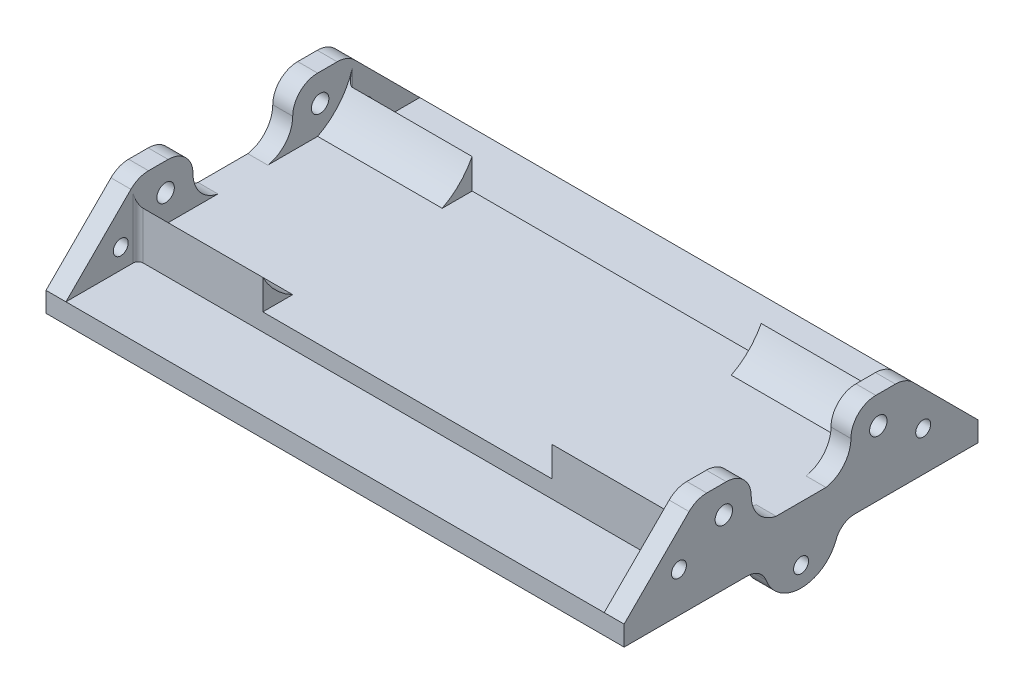
from build123d import *

# Parameters (mm, degrees)
BOSS_EXTRUDE1_START             = 3.5
SKETCH1_W                       = 116
SKETCH1_H                       = 42
BOSS_EXTRUDE1_DEPTH             = 3.5
BOSS_EXTRUDE2_REACH             = 64.081
SKETCH2_R                       = 1.75
BOSS_EXTRUDE2_DIRECTION_2_REACH = 64.081
SKETCH2_3_R                     = 1.75
CUT_EXTRUDE1_DEPTH              = 54
BOSS_EXTRUDE3_DEPTH             = 25
BOSS_EXTRUDE5_START             = -4
SKETCH4_R                       = 1.5
BOSS_EXTRUDE5_DEPTH             = 4
SKETCH5_R                       = 1.5
BOSS_EXTRUDE6_DEPTH             = 4
FILLET1_R                       = 5
FILLET2_R                       = 1
SKETCH6_W                       = 116
SKETCH6_H                       = 71
BOSS_EXTRUDE7_DEPTH             = 4
SKETCH7_R                       = 1.5
BOSS_EXTRUDE8_DEPTH             = 4
LPATTERN1_COUNT                 = 2
LPATTERN1_PITCH                 = 112
FILLET3_R                       = 4


with BuildPart() as part:
    # Sketch1 → Boss-Extrude1 (new body)
    with BuildSketch(Plane(origin=(0, 0, 0), x_dir=(1, 0, 0), z_dir=(0, 1, 0)).offset(BOSS_EXTRUDE1_START)):
        Rectangle(SKETCH1_W, SKETCH1_H)
    extrude(amount=BOSS_EXTRUDE1_DEPTH)

    # Boss-Extrude2: up to this face of the body (flat: up to its plane)
    boss_extrude2_end = Plane(part.part.faces().sort_by_distance((58, 5.25, 0))[0])
    # Sketch2 → Boss-Extrude2 (add, up to the picked face)
    with BuildSketch(Plane(origin=(0, 0, 0), x_dir=(0, 0, -1), z_dir=(1, 0, 0)), mode=Mode.PRIVATE) as boss_extrude2_sk1:
        with BuildLine():
            ThreePointArc((10, 13), (8.586149806, 9.094875162), (5, 7))
            Line((5, 7), (10, 7))
            Line((10, 7), (21, 7))
            Line((21, 7), (21, 18))
            Line((21, 18), (15, 18))
            ThreePointArc((15, 18), (11.464466094, 16.535533906), (10, 13))
        make_face()
        with Locations(Location((15.5, 12.475, 0), (0, 0, 180))):
            Circle(SKETCH2_R, mode=Mode.SUBTRACT)
    boss_extrude2_tool1 = split(extrude(boss_extrude2_sk1.sketch, amount=BOSS_EXTRUDE2_REACH, mode=Mode.PRIVATE), bisect_by=boss_extrude2_end, keep=Keep.BOTH, mode=Mode.PRIVATE)
    # Sketch2 → Boss-Extrude2 (add, up to the picked face)
    with BuildSketch(Plane(origin=(0, 0, 0), x_dir=(0, 0, -1), z_dir=(1, 0, 0)), mode=Mode.PRIVATE) as boss_extrude2_sk2:
        with BuildLine():
            Line((-21, 18), (-21, 7))
            Line((-21, 7), (-5, 7))
            ThreePointArc((-5, 7), (-8.586149806, 9.094875162), (-10, 13))
            ThreePointArc((-10, 13), (-11.464466094, 16.535533906), (-15, 18))
            Line((-15, 18), (-21, 18))
        make_face()
        with Locations(Location((-15.5, 12.475, 0), (0, 0, 180))):
            Circle(SKETCH2_R, mode=Mode.SUBTRACT)
    boss_extrude2_tool2 = split(extrude(boss_extrude2_sk2.sketch, amount=BOSS_EXTRUDE2_REACH, mode=Mode.PRIVATE), bisect_by=boss_extrude2_end, keep=Keep.BOTH, mode=Mode.PRIVATE)
    add(boss_extrude2_tool1.solids().sort_by(Axis((0, 8.970574, -8.735311), (1, 0, 0)))[0])
    add(boss_extrude2_tool2.solids().sort_by(Axis((0, 12.5, 20.805835), (1, 0, 0)))[0])

    # Boss-Extrude2 direction 2: up to this face of the body (flat: up to its plane)
    boss_extrude2_direction_2_end = Plane(part.part.faces().sort_by_distance((-58, 5.25, 0))[0])
    # Sketch2 → Boss-Extrude2 direction 2 (add, up to the picked face)
    with BuildSketch(Plane(origin=(0, 0, 0), x_dir=(0, 0, -1), z_dir=(1, 0, 0)), mode=Mode.PRIVATE) as boss_extrude2_direction_2_sk1:
        with BuildLine():
            ThreePointArc((10, 13), (8.586149806, 9.094875162), (5, 7))
            Line((5, 7), (10, 7))
            Line((10, 7), (21, 7))
            Line((21, 7), (21, 18))
            Line((21, 18), (15, 18))
            ThreePointArc((15, 18), (11.464466094, 16.535533906), (10, 13))
        make_face()
        with Locations(Location((15.5, 12.475, 0), (0, 0, 180))):
            Circle(SKETCH2_R, mode=Mode.SUBTRACT)
    boss_extrude2_direction_2_tool1 = split(extrude(boss_extrude2_direction_2_sk1.sketch, amount=-BOSS_EXTRUDE2_DIRECTION_2_REACH, mode=Mode.PRIVATE), bisect_by=boss_extrude2_direction_2_end, keep=Keep.BOTH, mode=Mode.PRIVATE)
    # Sketch2 → Boss-Extrude2 direction 2 (add, up to the picked face)
    with BuildSketch(Plane(origin=(0, 0, 0), x_dir=(0, 0, -1), z_dir=(1, 0, 0)), mode=Mode.PRIVATE) as boss_extrude2_direction_2_sk2:
        with BuildLine():
            Line((-21, 18), (-21, 7))
            Line((-21, 7), (-5, 7))
            ThreePointArc((-5, 7), (-8.586149806, 9.094875162), (-10, 13))
            ThreePointArc((-10, 13), (-11.464466094, 16.535533906), (-15, 18))
            Line((-15, 18), (-21, 18))
        make_face()
        with Locations(Location((-15.5, 12.475, 0), (0, 0, 180))):
            Circle(SKETCH2_R, mode=Mode.SUBTRACT)
    boss_extrude2_direction_2_tool2 = split(extrude(boss_extrude2_direction_2_sk2.sketch, amount=-BOSS_EXTRUDE2_DIRECTION_2_REACH, mode=Mode.PRIVATE), bisect_by=boss_extrude2_direction_2_end, keep=Keep.BOTH, mode=Mode.PRIVATE)
    add(boss_extrude2_direction_2_tool1.solids().sort_by(Axis((0, 8.970574, -8.735311), (-1, 0, 0)))[0])
    add(boss_extrude2_direction_2_tool2.solids().sort_by(Axis((0, 12.5, 20.805835), (-1, 0, 0)))[0])

    # Sketch2<3> → Cut-Extrude1 (cut, symmetric)
    # profile 1 of 2: a face of its own
    with BuildSketch(Plane(origin=(0, 0, 0), x_dir=(0, 0, -1), z_dir=(1, 0, 0))):
        with BuildLine():
            ThreePointArc((10, 13), (8.586149806, 9.094875162), (5, 7))
            Line((5, 7), (10, 7))
            Line((10, 7), (21, 7))
            Line((21, 7), (21, 18))
            Line((21, 18), (15, 18))
            ThreePointArc((15, 18), (11.464466094, 16.535533906), (10, 13))
        make_face()
        with Locations((15.5, 12.475)):
            Circle(SKETCH2_3_R, mode=Mode.SUBTRACT)
    # profile 2 of 2: a face of its own
    with BuildSketch(Plane(origin=(0, 0, 0), x_dir=(0, 0, -1), z_dir=(1, 0, 0))):
        with BuildLine():
            Line((-21, 18), (-21, 7))
            Line((-21, 7), (-5, 7))
            ThreePointArc((-5, 7), (-8.586149806, 9.094875162), (-10, 13))
            ThreePointArc((-10, 13), (-11.464466094, 16.535533906), (-15, 18))
            Line((-15, 18), (-21, 18))
        make_face()
        with Locations((-15.5, 12.475)):
            Circle(SKETCH2_3_R, mode=Mode.SUBTRACT)
    extrude(amount=CUT_EXTRUDE1_DEPTH, both=True, mode=Mode.SUBTRACT)

    # Sketch3 → Boss-Extrude3 (add)
    with BuildSketch(Plane(origin=(-54, 0, 0), x_dir=(0, 0, -1), z_dir=(1, 0, 0))):
        with BuildLine():
            Line((-21, 7), (-15, 7))
            ThreePointArc((-15, 7), (-18.465513805, 9.534486195), (-21, 13))
            Line((-21, 13), (-21, 7))
        make_face()
        with BuildLine():
            Line((21, 7), (21, 13))
            ThreePointArc((21, 13), (18.465513805, 9.534486195), (15, 7))
            Line((15, 7), (21, 7))
        make_face()
    boss_extrude3 = extrude(amount=BOSS_EXTRUDE3_DEPTH)

    # Mirror4: Boss-Extrude3 across plane
    add(boss_extrude3.mirror(Plane(origin=(0, 0, 0), x_dir=(0, 0, 1), z_dir=(1, 0, 0))))

    # Sketch4 → Boss-Extrude5 (add)
    # profile 1 of 2: a face of its own
    with BuildSketch(Plane.ZY.offset(58).offset(BOSS_EXTRUDE5_START)):
        Polygon((21, 18), (35.5, 3.5), (21, 3.5), align=None)
        with Locations((24.5, 7.5)):
            Circle(SKETCH4_R, mode=Mode.SUBTRACT)
    # profile 2 of 2: a face of its own
    with BuildSketch(Plane.ZY.offset(58).offset(BOSS_EXTRUDE5_START)):
        Polygon((-21, 18), (-21, 3.5), (-35.5, 3.5), align=None)
        with Locations(Location((-24.5, 7.5, 0), (0, 0, 180))):
            Circle(SKETCH4_R, mode=Mode.SUBTRACT)
    extrude(amount=BOSS_EXTRUDE5_DEPTH)

    # Sketch5 → Boss-Extrude6 (add)
    # profile 1 of 2: a face of its own
    with BuildSketch(Plane(origin=(58, 0, 0), x_dir=(0, 0, -1), z_dir=(1, 0, 0))):
        Polygon((-35.5, 3.5), (-21, 18), (-21, 3.5), align=None)
        with Locations(Location((-24.5, 7.5, 0), (0, 0, 180))):
            Circle(SKETCH5_R, mode=Mode.SUBTRACT)
    # profile 2 of 2: a face of its own
    with BuildSketch(Plane(origin=(58, 0, 0), x_dir=(0, 0, -1), z_dir=(1, 0, 0))):
        Polygon((21, 18), (21, 3.5), (35.5, 3.5), align=None)
        with Locations((24.5, 7.5)):
            Circle(SKETCH5_R, mode=Mode.SUBTRACT)
    extrude(amount=-BOSS_EXTRUDE6_DEPTH)

    # Fillet1
    fillet1_edges = [part.edges().sort_by_distance(p)[0] for p in [
        (56, 18, -21),
        (56, 18, 21),
        (-56, 18, 21),
        (-56, 18, -21),
    ]]
    fillet(fillet1_edges, radius=FILLET1_R)

    # Fillet2
    fillet2_edges = [part.edges().sort_by_distance(p)[0] for p in [
        (-54, 8.25, 21),
        (-54, 8.25, -21),
        (54, 8.25, 21),
        (54, 8.25, -21),
    ]]
    fillet(fillet2_edges, radius=FILLET2_R)

    # Sketch6 → Boss-Extrude7 (add)
    with BuildSketch(Plane.XZ.offset(-3.5)):
        Rectangle(SKETCH6_W, SKETCH6_H)
    extrude(amount=BOSS_EXTRUDE7_DEPTH)

    # Sketch7 → Boss-Extrude8 (add)
    with BuildSketch(Plane.ZY.offset(58)):
        with BuildLine():
            Line((7.5, -0.5), (-7.5, -0.5))
            ThreePointArc((-7.5, -0.5), (0, -8), (7.5, -0.5))
        make_face()
        with Locations((0, -4)):
            Circle(SKETCH7_R, mode=Mode.SUBTRACT)
    boss_extrude8 = extrude(amount=-BOSS_EXTRUDE8_DEPTH)

    # LPattern1: Boss-Extrude8 ×2
    with Locations(*[(i * LPATTERN1_PITCH, 0, 0) for i in range(1, LPATTERN1_COUNT)]):
        add(boss_extrude8)

    # Fillet3
    fillet3_edges = [part.edges().sort_by_distance(p)[0] for p in [
        (-56, -0.5, 7.5),
        (-56, -0.5, -7.5),
        (56, -0.5, 7.5),
        (56, -0.5, -7.5),
    ]]
    fillet(fillet3_edges, radius=FILLET3_R)


solid = part.part
